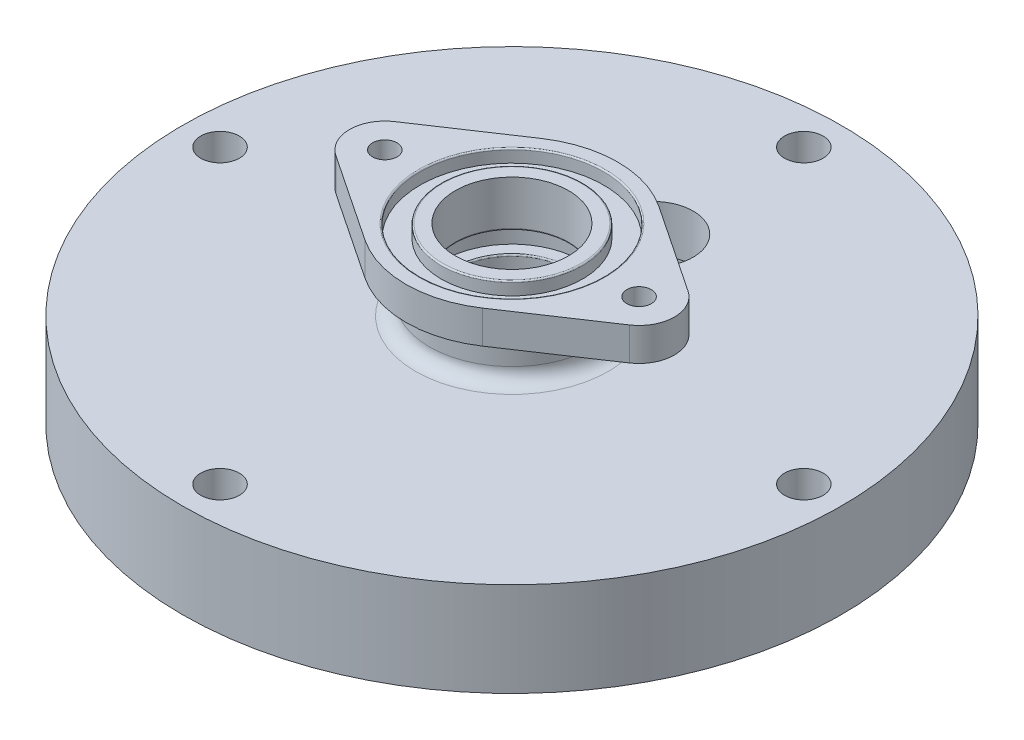
from build123d import *

# Parameters (mm, degrees)
IZIM1_R                     = 70
Y_KSEKLIK_EKSTR_ZYON1_DEPTH = 20
IZIM2_R                     = 50.03
IZIM2_R_2                   = 45
IZIM2_R_3                   = 41
IZIM2_R_4                   = 17.35
KES_EKSTR_ZYON1_DEPTH       = 10
IZIM5_R                     = 17.5
Y_KSEKLIK_EKSTR_ZYON2_DEPTH = 10
IZIM7_R                     = 2.6
Y_KSEKLIK_EKSTR_ZYON3_DEPTH = 7
IZIM8_R                     = 12.025
KES_EKSTR_ZYON3_DEPTH       = 106.683489723
IZIM9_R                     = 19.525
IZIM9_R_2                   = 15.025
KES_EKSTR_ZYON4_DEPTH       = 2.75
RADYUS1_R                   = 0.3
RADYUS2_R                   = 3
IZIM10_W                    = 2.75
IZIM10_H                    = 4.5
RADYUS3_R                   = 0.3
IZIM12_R                    = 4.1
KES_EKSTR_ZYON5_DEPTH       = 101.995049384
IZIM13_R                    = 8.5
KES_EKSTR_ZYON6_DEPTH       = 10
IZIM14_R                    = 50.03
IZIM14_R_2                  = 45
KES_EKSTR_ZYON7_DEPTH       = 3


with BuildPart() as part:
    # Çizim1 → Yükseklik-Ekstrüzyon1 (new body)
    with BuildSketch(Plane(origin=(0, 0, 0), x_dir=(1, 0, 0), z_dir=(0, 1, 0))):
        with Locations(Location((0, 0, 0), (0, 0, 270))):
            Circle(IZIM1_R)
    extrude(amount=Y_KSEKLIK_EKSTR_ZYON1_DEPTH)

    # Çizim2 → Kes-Ekstrüzyon1 (cut)
    # profile 1 of 2: a face of its own
    with BuildSketch(Plane.XZ):
        with Locations(Location((0, 0, 0), (0, 0, 270))):
            Circle(IZIM2_R)
        with Locations(Location((0, 0, 0), (0, 0, 270))):
            Circle(IZIM2_R_2, mode=Mode.SUBTRACT)
    # profile 2 of 2: a face of its own
    with BuildSketch(Plane.XZ):
        with Locations(Location((0, 0, 0), (0, 0, 270))):
            Circle(IZIM2_R_3)
        with Locations(Location((0, 0, 0), (0, 0, 270))):
            Circle(IZIM2_R_4, mode=Mode.SUBTRACT)
    extrude(amount=-KES_EKSTR_ZYON1_DEPTH, mode=Mode.SUBTRACT)

    # Çizim4 → Kes-Döndür1 (revolve, cut)
    with BuildSketch(Plane.XY, mode=Mode.PRIVATE) as kes_d_nd_r1_sk:
        Polygon((-17.35, 10), (-17.35, 0), (-13.6, 0), align=None)
    revolve(kes_d_nd_r1_sk.sketch.rotate(Axis((0, 0, 0), (0, 1, 0)), 270), axis=Axis((0, 0, 0), (0, 1, 0)), mode=Mode.SUBTRACT)

    # Çizim5 → Yükseklik-Ekstrüzyon2 (add)
    with BuildSketch(Plane(origin=(0, 20, 0), x_dir=(1, 0, 0), z_dir=(0, 1, 0))):
        with Locations(Location((0, 0, 0), (0, 0, 270))):
            Circle(IZIM5_R)
    extrude(amount=Y_KSEKLIK_EKSTR_ZYON2_DEPTH)

    # Çizim7 → Yükseklik-Ekstrüzyon3 (add)
    with BuildSketch(Plane(origin=(0, 30, 0), x_dir=(1, 0, 0), z_dir=(0, 1, 0))):
        with BuildLine():
            Line((31.166666667, -6.236095645), (12.5, -18.708286934))
            ThreePointArc((12.5, -18.708286934), (0, -22.5), (-12.5, -18.708286934))
            Line((-12.5, -18.708286934), (-31.166666667, -6.236095645))
            ThreePointArc((-31.166666667, -6.236095645), (-34.5, 0), (-31.166666667, 6.236095645))
            Line((-31.166666667, 6.236095645), (-12.5, 18.708286934))
            ThreePointArc((-12.5, 18.708286934), (0, 22.5), (12.5, 18.708286934))
            Line((12.5, 18.708286934), (31.166666667, 6.236095645))
            ThreePointArc((31.166666667, 6.236095645), (34.5, 0), (31.166666667, -6.236095645))
        make_face()
        with Locations(Location((-27, 0, 0), (0, 0, 270))):
            Circle(IZIM7_R, mode=Mode.SUBTRACT)
        with Locations(Location((27, 0, 0), (0, 0, 270))):
            Circle(IZIM7_R, mode=Mode.SUBTRACT)
    extrude(amount=Y_KSEKLIK_EKSTR_ZYON3_DEPTH)

    # Çizim8 → Kes-Ekstrüzyon3 (cut, through all)
    with BuildSketch(Plane(origin=(0, 37, 0), x_dir=(1, 0, 0), z_dir=(0, 1, 0))):
        with Locations(Location((0, 0, 0), (0, 0, 270))):
            Circle(IZIM8_R)
    extrude(amount=-KES_EKSTR_ZYON3_DEPTH, mode=Mode.SUBTRACT)

    # Çizim9 → Kes-Ekstrüzyon4 (cut)
    with BuildSketch(Plane(origin=(0, 37, 0), x_dir=(1, 0, 0), z_dir=(0, 1, 0))):
        with Locations(Location((0, 0, 0), (0, 0, 270))):
            Circle(IZIM9_R)
        with Locations(Location((0, 0, 0), (0, 0, 270))):
            Circle(IZIM9_R_2, mode=Mode.SUBTRACT)
    extrude(amount=-KES_EKSTR_ZYON4_DEPTH, mode=Mode.SUBTRACT)

    # Radyus1
    radyus1_edges = [part.edges().sort_by_distance(p)[0] for p in [
        (0, 37, -19.525),
        (0, 37, -15.025),
    ]]
    fillet(radyus1_edges, radius=RADYUS1_R)

    # Radyus2
    radyus2_edges = [part.edges().sort_by_distance(p)[0] for p in [
        (0, 20, -17.5),
        (0, 30, -17.5),
    ]]
    fillet(radyus2_edges, radius=RADYUS2_R)

    # Çizim10 → Kes-Döndür2 (revolve, cut)
    with BuildSketch(Plane.XY, mode=Mode.PRIVATE) as kes_d_nd_r2_sk:
        with Locations((-13.375, 24.981859074)):
            Rectangle(IZIM10_W, IZIM10_H)
    revolve(kes_d_nd_r2_sk.sketch.rotate(Axis((0, 0, 0), (0, 1, 0)), 90), axis=Axis((0, 0, 0), (0, 1, 0)), mode=Mode.SUBTRACT)

    # Radyus3
    radyus3_edges = [part.edges().sort_by_distance(p)[0] for p in [
        (0, 27.231859074, -12.025),
        (0, 22.731859074, -12.025),
    ]]
    fillet(radyus3_edges, radius=RADYUS3_R)

    # Çizim12 → Kes-Ekstrüzyon5 (cut, through all)
    with BuildSketch(Plane(origin=(0, 20, 0), x_dir=(1, 0, 0), z_dir=(0, 1, 0))):
        with Locations(Location((0, 62, 0), (0, 0, 270))):
            Circle(IZIM12_R)
        with Locations(Location((62, 0, 0), (0, 0, 270))):
            Circle(IZIM12_R)
        with Locations(Location((0, -62, 0), (0, 0, 270))):
            Circle(IZIM12_R)
        with Locations(Location((-62, 0, 0), (0, 0, 270))):
            Circle(IZIM12_R)
    extrude(amount=-KES_EKSTR_ZYON5_DEPTH, mode=Mode.SUBTRACT)

    # Çizim13 → Kes-Ekstrüzyon6 (cut)
    with BuildSketch(Plane(origin=(0, 20, 0), x_dir=(1, 0, 0), z_dir=(0, 1, 0))):
        with Locations(Location((0, 30, 0), (0, 0, 270))):
            Circle(IZIM13_R)
    extrude(amount=-KES_EKSTR_ZYON6_DEPTH, mode=Mode.SUBTRACT)

    # Çizim14 → Kes-Ekstrüzyon7 (cut)
    with BuildSketch(Plane.XZ.offset(-10)):
        with Locations(Location((0, 0, 0), (0, 0, 270))):
            Circle(IZIM14_R)
        with Locations(Location((0, 0, 0), (0, 0, 270))):
            Circle(IZIM14_R_2, mode=Mode.SUBTRACT)
    extrude(amount=-KES_EKSTR_ZYON7_DEPTH, mode=Mode.SUBTRACT)


solid = part.part
